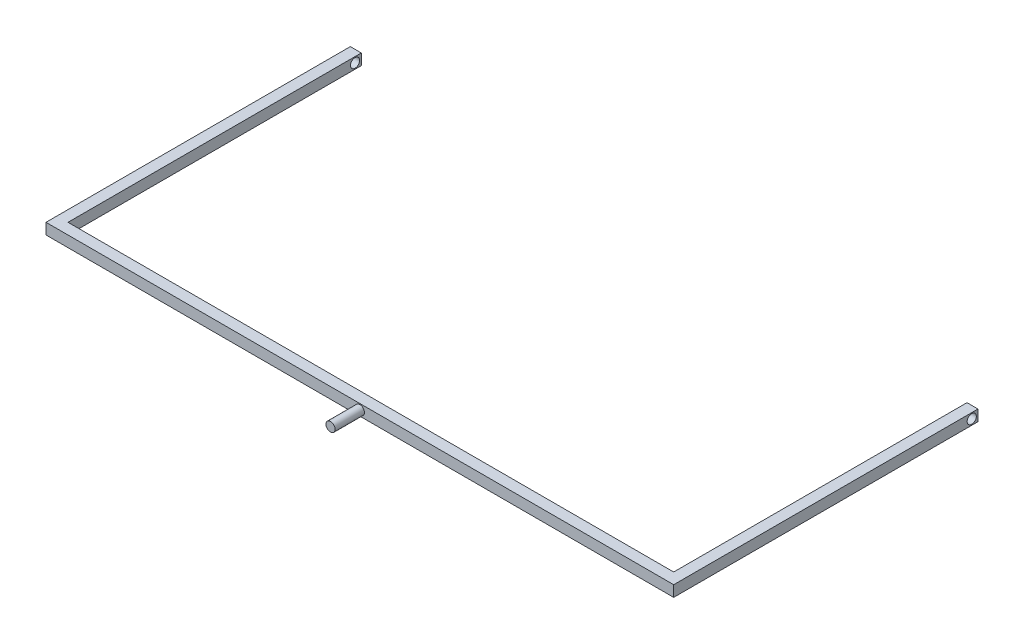
from build123d import *

# Parameters (mm, degrees)
EXTRUDE_1_DEPTH     = 30
SKETCH_3_R          = 12.5
CUT_EXTRUDE_1_DEPTH = 1903.825267858
SKETCH_5_R          = 12.5
CUT_EXTRUDE_2_DEPTH = 1355.510981868
EXTRUDE_START       = -110
SKETCH_7_R          = 12.5
EXTRUDE_3_DEPTH     = 110


with BuildPart() as part:
    # Эскиз1 → Бобышка-Вытянуть1 (new body)
    with BuildSketch(Plane(origin=(0, 0, 0), x_dir=(1, 0, 0), z_dir=(0, 1, 0))):
        Polygon((1070, 0), (-642, 0), (-642, 830), (-612, 830), (-612, 30), (1040, 30), (1040, 830), (1070, 830), align=None)
    extrude(amount=EXTRUDE_1_DEPTH)

    # Эскиз3 → Вырез-Вытянуть1 (cut, through all)
    with BuildSketch(Plane.ZY.offset(642)):
        with Locations((-813, 15)):
            Circle(SKETCH_3_R)
    extrude(amount=-CUT_EXTRUDE_1_DEPTH, mode=Mode.SUBTRACT)

    # Эскиз5 → Вырез-Вытянуть2 (cut, through all)
    with BuildSketch(Plane.XY):
        with Locations((214, 15)):
            Circle(SKETCH_5_R)
    extrude(amount=-CUT_EXTRUDE_2_DEPTH, mode=Mode.SUBTRACT)

    # Эскиз7 → Бобышка-Вытянуть3 (add)
    with BuildSketch(Plane(origin=(0, 0, -30), x_dir=(-1, 0, 0), z_dir=(0, 0, -1)).offset(EXTRUDE_START)):
        with Locations((-214, 15)):
            Circle(SKETCH_7_R)
    extrude(amount=EXTRUDE_3_DEPTH)


solid = part.part
